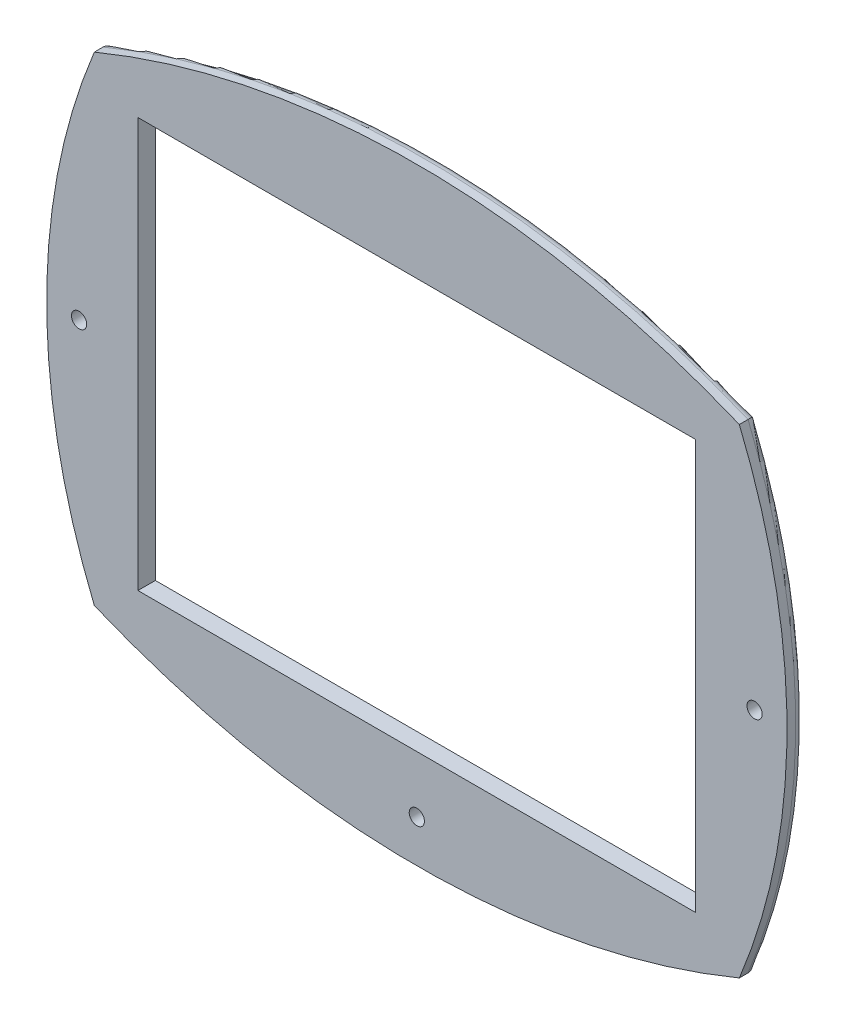
from build123d import *

# Parameters (mm, degrees)
SKETCH1_W           = 64
SKETCH1_H           = 47
BOSS_EXTRUDE1_DEPTH = 2
FILLET1_R           = 1
SKETCH2_R           = 0.875
CUT_EXTRUDE1_DEPTH  = 55.981008251


with BuildPart() as part:
    # Sketch1 → Boss-Extrude1 (new body)
    # profile 1 of 2: a face of its own
    with BuildSketch(Plane.XY):
        with BuildLine():
            ThreePointArc((37, 27.5), (42.470090103, 0), (37, -27.5))
            ThreePointArc((37, -27.5), (0, -34.859757593), (-37, -27.5))
            ThreePointArc((-37, -27.5), (-42.470090103, 0), (-37, 27.5))
            ThreePointArc((-37, 27.5), (0, 34.859757593), (37, 27.5))
        make_face()
        with BuildLine():
            ThreePointArc((36, -25.5), (40.468092327, 0), (36, 25.5))
            ThreePointArc((36, 25.5), (0, 32.351769079), (-36, 25.5))
            ThreePointArc((-36, 25.5), (-40.468092327, 0), (-36, -25.5))
            ThreePointArc((-36, -25.5), (0, -32.351769079), (36, -25.5))
        make_face(mode=Mode.SUBTRACT)
    # profile 2 of 2: a face of its own
    with BuildSketch(Plane.XY):
        with BuildLine():
            ThreePointArc((36, -25.5), (0, -32.351769079), (-36, -25.5))
            ThreePointArc((-36, -25.5), (-40.468092327, 0), (-36, 25.5))
            ThreePointArc((-36, 25.5), (0, 32.351769079), (36, 25.5))
            ThreePointArc((36, 25.5), (40.468092327, 0), (36, -25.5))
        make_face()
        Rectangle(SKETCH1_W, SKETCH1_H, mode=Mode.SUBTRACT)
    extrude(amount=BOSS_EXTRUDE1_DEPTH)

    # Fillet1
    fillet1_edges = [part.edges().sort_by_distance(p)[0] for p in [
        (-42.470090103, 0, 0),
        (0, -34.859757593, 0),
        (0, 34.859757593, 0),
        (42.470090103, 0, 0),
    ]]
    fillet(fillet1_edges, radius=FILLET1_R)

    # Sketch2 → Cut-Extrude1 (cut, through all)
    with BuildSketch(Plane(origin=(0, 0, 0), x_dir=(-1, 0, 0), z_dir=(0, 0, -1))):
        with Locations((-38.75, 0)):
            Circle(SKETCH2_R)
        with Locations((0, -30)):
            Circle(SKETCH2_R)
        with Locations((38.75, 0)):
            Circle(SKETCH2_R)
    extrude(amount=-CUT_EXTRUDE1_DEPTH, mode=Mode.SUBTRACT)


solid = part.part
